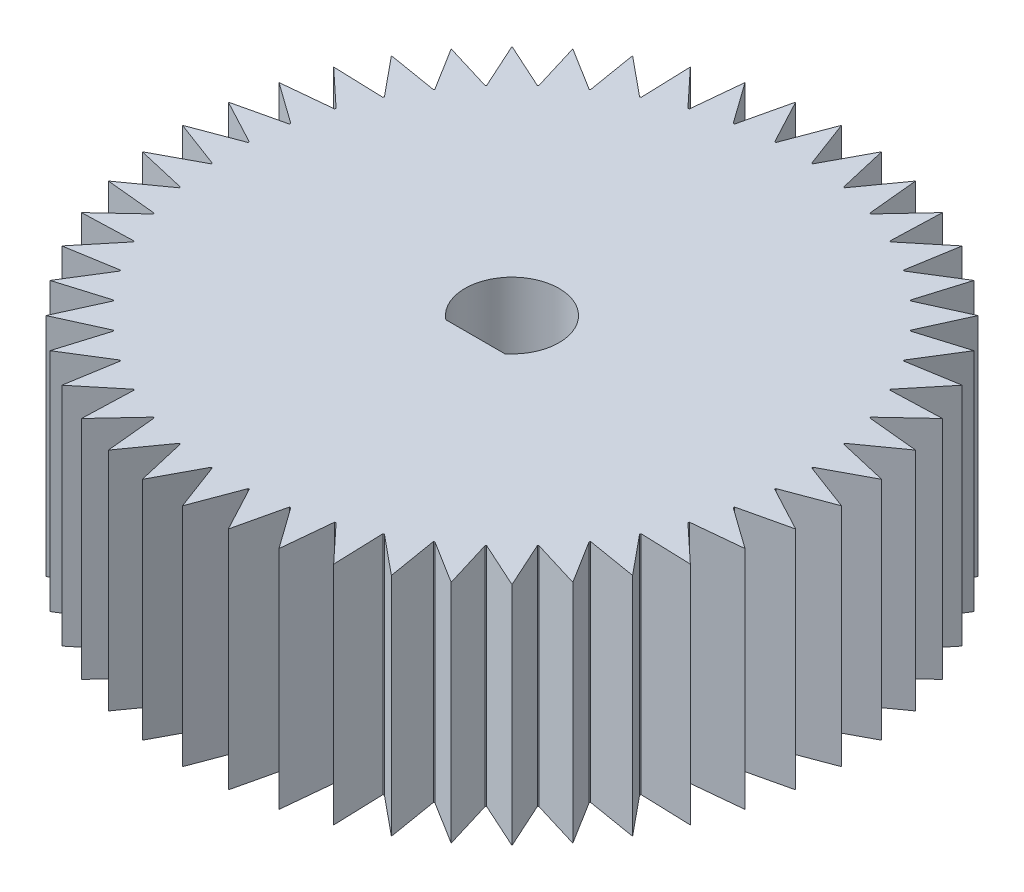
from build123d import *

# Parameters (mm, degrees)
EXTRUDE_5_DEPTH     = 12
SKETCH_2_R          = 4
EXTRUDE_6_DEPTH     = 4
CUT_EXTRUDE_START   = -4
CUT_EXTRUDE_1_DEPTH = 4


with BuildPart() as part:
    # Эскиз1 → Бобышка-Вытянуть5 (new body)
    with BuildSketch(Plane(origin=(0, 0, 0), x_dir=(1, 0, 0), z_dir=(0, 1, 0))):
        with BuildLine():
            Line((2.895366476, 14.71790926), (2.284208364, 17.350285074))
            Line((2.284208364, 17.350285074), (1.012565965, 14.965784649))
            ThreePointArc((1.012565965, 14.965784649), (0.981046938, 14.967883849), (0.949523561, 14.969916667))
            Line((0.949523561, 14.969916667), (0, 17.5))
            Line((0, 17.5), (-0.949523561, 14.969916667))
            ThreePointArc((-0.949523561, 14.969916667), (-0.981046938, 14.967883849), (-1.012565965, 14.965784649))
            Line((-1.012565965, 14.965784649), (-2.284208364, 17.350285074))
            Line((-2.284208364, 17.350285074), (-2.895366476, 14.71790926))
            ThreePointArc((-2.895366476, 14.71790926), (-2.92635483, 14.711779206), (-2.957330207, 14.705583907))
            Line((-2.957330207, 14.705583907), (-4.529333289, 16.90370196))
            Line((-4.529333289, 16.90370196), (-4.791668867, 14.214074344))
            ThreePointArc((-4.791668867, 14.214074344), (-4.82159198, 14.203951942), (-4.851493708, 14.193766547))
            Line((-4.851493708, 14.193766547), (-6.696960066, 16.167891819))
            Line((-6.696960066, 16.167891819), (-6.605984476, 13.467032676))
            ThreePointArc((-6.605984476, 13.467032676), (-6.634330353, 13.453091123), (-6.662646808, 13.439089906))
            Line((-6.662646808, 13.439089906), (-8.75, 15.155444566))
            Line((-8.75, 15.155444566), (-8.307269859, 12.489566345))
            ThreePointArc((-8.307269859, 12.489566345), (-8.333553495, 12.472044185), (-8.359800173, 12.454466711))
            Line((-8.359800173, 12.454466711), (-10.653325008, 13.883683455))
            Line((-10.653325008, 13.883683455), (-9.866415551, 11.298400071))
            ThreePointArc((-9.866415551, 11.298400071), (-9.890187227, 11.277597112), (-9.91391504, 11.256744138))
            Line((-9.91391504, 11.256744138), (-12.374368671, 12.374368671))
            Line((-12.374368671, 12.374368671), (-11.256744138, 9.91391504))
            ThreePointArc((-11.256744138, 9.91391504), (-11.277597112, 9.890187227), (-11.298400071, 9.866415551))
            Line((-11.298400071, 9.866415551), (-13.883683455, 10.653325008))
            Line((-13.883683455, 10.653325008), (-12.454466711, 8.359800173))
            ThreePointArc((-12.454466711, 8.359800173), (-12.472044185, 8.333553495), (-12.489566345, 8.307269859))
            Line((-12.489566345, 8.307269859), (-15.155444566, 8.75))
            Line((-15.155444566, 8.75), (-13.439089906, 6.662646808))
            ThreePointArc((-13.439089906, 6.662646808), (-13.453091123, 6.634330353), (-13.467032676, 6.605984476))
            Line((-13.467032676, 6.605984476), (-16.167891819, 6.696960066))
            Line((-16.167891819, 6.696960066), (-14.193766547, 4.851493708))
            ThreePointArc((-14.193766547, 4.851493708), (-14.203951942, 4.82159198), (-14.214074344, 4.791668867))
            Line((-14.214074344, 4.791668867), (-16.90370196, 4.529333289))
            Line((-16.90370196, 4.529333289), (-14.705583907, 2.957330207))
            ThreePointArc((-14.705583907, 2.957330207), (-14.711779206, 2.92635483), (-14.71790926, 2.895366476))
            Line((-14.71790926, 2.895366476), (-17.350285074, 2.284208364))
            Line((-17.350285074, 2.284208364), (-14.965784649, 1.012565965))
            ThreePointArc((-14.965784649, 1.012565965), (-14.967883849, 0.981046938), (-14.969916667, 0.949523561))
            Line((-14.969916667, 0.949523561), (-17.5, 0))
            Line((-17.5, 0), (-14.969916667, -0.949523561))
            ThreePointArc((-14.969916667, -0.949523561), (-14.967883849, -0.981046938), (-14.965784649, -1.012565965))
            Line((-14.965784649, -1.012565965), (-17.350285074, -2.284208364))
            Line((-17.350285074, -2.284208364), (-14.71790926, -2.895366476))
            ThreePointArc((-14.71790926, -2.895366476), (-14.711779206, -2.92635483), (-14.705583907, -2.957330207))
            Line((-14.705583907, -2.957330207), (-16.90370196, -4.529333289))
            Line((-16.90370196, -4.529333289), (-14.214074344, -4.791668867))
            ThreePointArc((-14.214074344, -4.791668867), (-14.203951942, -4.82159198), (-14.193766547, -4.851493708))
            Line((-14.193766547, -4.851493708), (-16.167891819, -6.696960066))
            Line((-16.167891819, -6.696960066), (-13.467032676, -6.605984476))
            ThreePointArc((-13.467032676, -6.605984476), (-13.453091123, -6.634330353), (-13.439089906, -6.662646808))
            Line((-13.439089906, -6.662646808), (-15.155444566, -8.75))
            Line((-15.155444566, -8.75), (-12.489566345, -8.307269859))
            ThreePointArc((-12.489566345, -8.307269859), (-12.472044185, -8.333553495), (-12.454466711, -8.359800173))
            Line((-12.454466711, -8.359800173), (-13.883683455, -10.653325008))
            Line((-13.883683455, -10.653325008), (-11.298400071, -9.866415551))
            ThreePointArc((-11.298400071, -9.866415551), (-11.277597112, -9.890187227), (-11.256744138, -9.91391504))
            Line((-11.256744138, -9.91391504), (-12.374368671, -12.374368671))
            Line((-12.374368671, -12.374368671), (-9.91391504, -11.256744138))
            ThreePointArc((-9.91391504, -11.256744138), (-9.890187227, -11.277597112), (-9.866415551, -11.298400071))
            Line((-9.866415551, -11.298400071), (-10.653325008, -13.883683455))
            Line((-10.653325008, -13.883683455), (-8.359800173, -12.454466711))
            ThreePointArc((-8.359800173, -12.454466711), (-8.333553495, -12.472044185), (-8.307269859, -12.489566345))
            Line((-8.307269859, -12.489566345), (-8.75, -15.155444566))
            Line((-8.75, -15.155444566), (-6.662646808, -13.439089906))
            ThreePointArc((-6.662646808, -13.439089906), (-6.634330353, -13.453091123), (-6.605984476, -13.467032676))
            Line((-6.605984476, -13.467032676), (-6.696960066, -16.167891819))
            Line((-6.696960066, -16.167891819), (-4.851493708, -14.193766547))
            ThreePointArc((-4.851493708, -14.193766547), (-4.82159198, -14.203951942), (-4.791668867, -14.214074344))
            Line((-4.791668867, -14.214074344), (-4.529333289, -16.90370196))
            Line((-4.529333289, -16.90370196), (-2.957330207, -14.705583907))
            ThreePointArc((-2.957330207, -14.705583907), (-2.92635483, -14.711779206), (-2.895366476, -14.71790926))
            Line((-2.895366476, -14.71790926), (-2.284208364, -17.350285074))
            Line((-2.284208364, -17.350285074), (-1.012565965, -14.965784649))
            ThreePointArc((-1.012565965, -14.965784649), (-0.981046938, -14.967883849), (-0.949523561, -14.969916667))
            Line((-0.949523561, -14.969916667), (0, -17.5))
            Line((0, -17.5), (0.949523561, -14.969916667))
            ThreePointArc((0.949523561, -14.969916667), (0.981046938, -14.967883849), (1.012565965, -14.965784649))
            Line((1.012565965, -14.965784649), (2.284208364, -17.350285074))
            Line((2.284208364, -17.350285074), (2.895366476, -14.71790926))
            ThreePointArc((2.895366476, -14.71790926), (2.92635483, -14.711779206), (2.957330207, -14.705583907))
            Line((2.957330207, -14.705583907), (4.529333289, -16.90370196))
            Line((4.529333289, -16.90370196), (4.791668867, -14.214074344))
            ThreePointArc((4.791668867, -14.214074344), (4.82159198, -14.203951942), (4.851493708, -14.193766547))
            Line((4.851493708, -14.193766547), (6.696960066, -16.167891819))
            Line((6.696960066, -16.167891819), (6.605984476, -13.467032676))
            ThreePointArc((6.605984476, -13.467032676), (6.634330353, -13.453091123), (6.662646808, -13.439089906))
            Line((6.662646808, -13.439089906), (8.75, -15.155444566))
            Line((8.75, -15.155444566), (8.307269859, -12.489566345))
            ThreePointArc((8.307269859, -12.489566345), (8.333553495, -12.472044185), (8.359800173, -12.454466711))
            Line((8.359800173, -12.454466711), (10.653325008, -13.883683455))
            Line((10.653325008, -13.883683455), (9.866415551, -11.298400071))
            ThreePointArc((9.866415551, -11.298400071), (9.890187227, -11.277597112), (9.91391504, -11.256744138))
            Line((9.91391504, -11.256744138), (12.374368671, -12.374368671))
            Line((12.374368671, -12.374368671), (11.256744138, -9.91391504))
            ThreePointArc((11.256744138, -9.91391504), (11.277597112, -9.890187227), (11.298400071, -9.866415551))
            Line((11.298400071, -9.866415551), (13.883683455, -10.653325008))
            Line((13.883683455, -10.653325008), (12.454466711, -8.359800173))
            ThreePointArc((12.454466711, -8.359800173), (12.472044185, -8.333553495), (12.489566345, -8.307269859))
            Line((12.489566345, -8.307269859), (15.155444566, -8.75))
            Line((15.155444566, -8.75), (13.439089906, -6.662646808))
            ThreePointArc((13.439089906, -6.662646808), (13.453091123, -6.634330353), (13.467032676, -6.605984476))
            Line((13.467032676, -6.605984476), (16.167891819, -6.696960066))
            Line((16.167891819, -6.696960066), (14.193766547, -4.851493708))
            ThreePointArc((14.193766547, -4.851493708), (14.203951942, -4.82159198), (14.214074344, -4.791668867))
            Line((14.214074344, -4.791668867), (16.90370196, -4.529333289))
            Line((16.90370196, -4.529333289), (14.705583907, -2.957330207))
            ThreePointArc((14.705583907, -2.957330207), (14.711779206, -2.92635483), (14.71790926, -2.895366476))
            Line((14.71790926, -2.895366476), (17.350285074, -2.284208364))
            Line((17.350285074, -2.284208364), (14.965784649, -1.012565965))
            ThreePointArc((14.965784649, -1.012565965), (14.967883849, -0.981046938), (14.969916667, -0.949523561))
            Line((14.969916667, -0.949523561), (17.5, 0))
            Line((17.5, 0), (14.969916667, 0.949523561))
            ThreePointArc((14.969916667, 0.949523561), (14.967883849, 0.981046938), (14.965784649, 1.012565965))
            Line((14.965784649, 1.012565965), (17.350285074, 2.284208364))
            Line((17.350285074, 2.284208364), (14.71790926, 2.895366476))
            ThreePointArc((14.71790926, 2.895366476), (14.711779206, 2.92635483), (14.705583907, 2.957330207))
            Line((14.705583907, 2.957330207), (16.90370196, 4.529333289))
            Line((16.90370196, 4.529333289), (14.214074344, 4.791668867))
            ThreePointArc((14.214074344, 4.791668867), (14.203951942, 4.82159198), (14.193766547, 4.851493708))
            Line((14.193766547, 4.851493708), (16.167891819, 6.696960066))
            Line((16.167891819, 6.696960066), (13.467032676, 6.605984476))
            ThreePointArc((13.467032676, 6.605984476), (13.453091123, 6.634330353), (13.439089906, 6.662646808))
            Line((13.439089906, 6.662646808), (15.155444566, 8.75))
            Line((15.155444566, 8.75), (12.489566345, 8.307269859))
            ThreePointArc((12.489566345, 8.307269859), (12.472044185, 8.333553495), (12.454466711, 8.359800173))
            Line((12.454466711, 8.359800173), (13.883683455, 10.653325008))
            Line((13.883683455, 10.653325008), (11.298400071, 9.866415551))
            ThreePointArc((11.298400071, 9.866415551), (11.277597112, 9.890187227), (11.256744138, 9.91391504))
            Line((11.256744138, 9.91391504), (12.374368671, 12.374368671))
            Line((12.374368671, 12.374368671), (9.91391504, 11.256744138))
            ThreePointArc((9.91391504, 11.256744138), (9.890187227, 11.277597112), (9.866415551, 11.298400071))
            Line((9.866415551, 11.298400071), (10.653325008, 13.883683455))
            Line((10.653325008, 13.883683455), (8.359800173, 12.454466711))
            ThreePointArc((8.359800173, 12.454466711), (8.333553495, 12.472044185), (8.307269859, 12.489566345))
            Line((8.307269859, 12.489566345), (8.75, 15.155444566))
            Line((8.75, 15.155444566), (6.662646808, 13.439089906))
            ThreePointArc((6.662646808, 13.439089906), (6.634330353, 13.453091123), (6.605984476, 13.467032676))
            Line((6.605984476, 13.467032676), (6.696960066, 16.167891819))
            Line((6.696960066, 16.167891819), (4.851493708, 14.193766547))
            ThreePointArc((4.851493708, 14.193766547), (4.82159198, 14.203951942), (4.791668867, 14.214074344))
            Line((4.791668867, 14.214074344), (4.529333289, 16.90370196))
            Line((4.529333289, 16.90370196), (2.957330207, 14.705583907))
            ThreePointArc((2.957330207, 14.705583907), (2.92635483, 14.711779206), (2.895366476, 14.71790926))
        make_face()
        with BuildLine():
            ThreePointArc((-1.564448785, -1.95), (0, 2.5), (1.564448785, -1.95))
            Line((1.564448785, -1.95), (-1.564448785, -1.95))
        make_face(mode=Mode.SUBTRACT)
    extrude(amount=EXTRUDE_5_DEPTH)

    # Эскиз2 → Бобышка-Вытянуть6 (add)
    with BuildSketch(Plane(origin=(0, 0, 0), x_dir=(1, 0, 0), z_dir=(0, 1, 0))):
        Circle(SKETCH_2_R)
    extrude(amount=-EXTRUDE_6_DEPTH)

    # Эскиз1<5> → Вырез-Вытянуть1 (cut)
    with BuildSketch(Plane(origin=(0, 0, 0), x_dir=(1, 0, 0), z_dir=(0, 1, 0)).offset(CUT_EXTRUDE_START)):
        with BuildLine():
            ThreePointArc((1.564448785, -1.95), (0, 2.5), (-1.564448785, -1.95))
            Line((-1.564448785, -1.95), (1.564448785, -1.95))
        make_face()
    extrude(amount=CUT_EXTRUDE_1_DEPTH, mode=Mode.SUBTRACT)


solid = part.part
